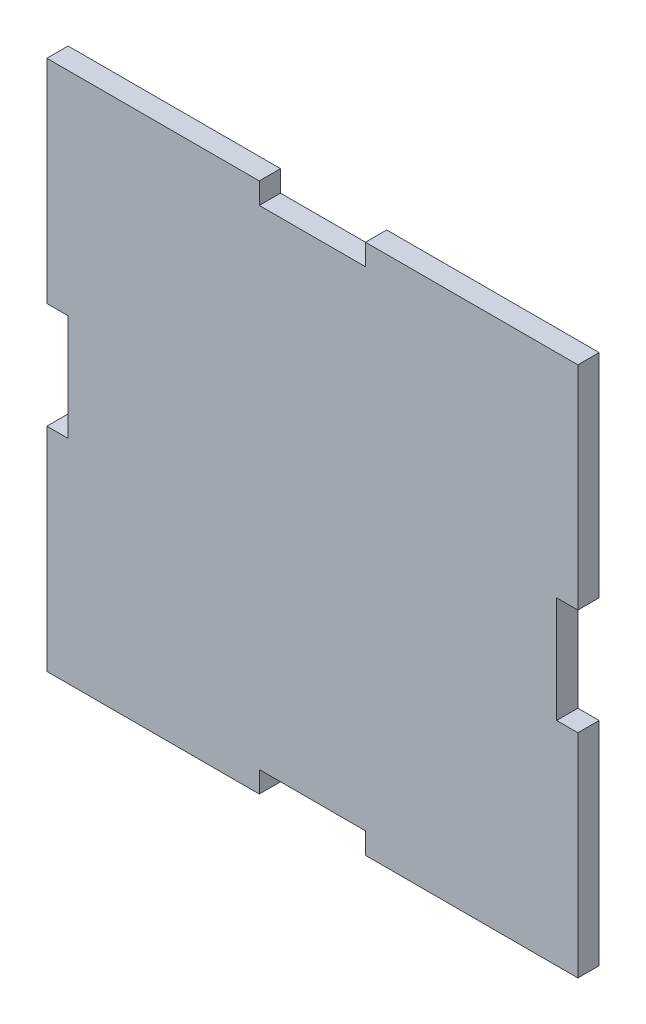
from build123d import *

# Parameters (mm, degrees)
EXTRUDE_1_DEPTH = 4


with BuildPart() as part:
    # 草图1 → 凸台-拉伸1 (new body)
    with BuildSketch(Plane.XY):
        Polygon((0, 40), (0, 0), (40, 0), (40, 4), (60, 4), (60, 0), (100, 0), (100, 40), (96, 40), (96, 60), (100, 60), (100, 100), (60, 100), (60, 96), (40, 96), (40, 100), (0, 100), (0, 60), (4, 60), (4, 40), align=None)
    extrude(amount=EXTRUDE_1_DEPTH)


solid = part.part
